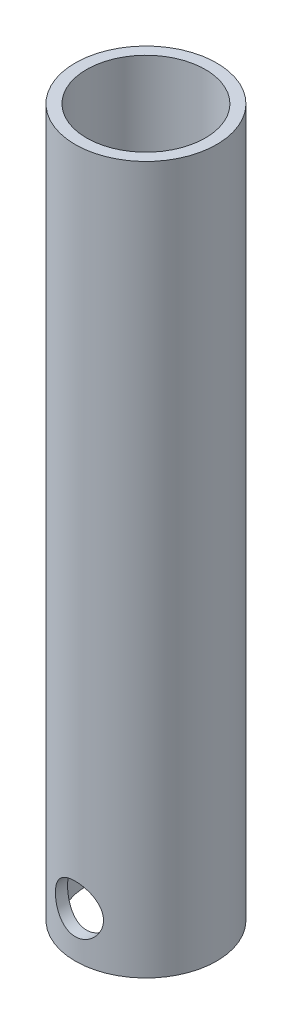
from build123d import *

# Parameters (mm, degrees)
SKETCH_1_R               = 12.5
SKETCH_1_R_2             = 10.5
EXTRUDE_1_DEPTH          = 125
CUT_EXTRUDE_1_DEPTH      = 127.24381173
CUT_EXTRUDE_1_DEPTH_BACK = 127.24381173
SKETCH_2_R               = 4.25
SKETCH_4_R               = 0.5
CUT_EXTRUDE_3_DEPTH      = 25


with BuildPart() as part:
    # Эскиз1 → Бобышка-Вытянуть1 (new body)
    with BuildSketch(Plane(origin=(0, 0, 0), x_dir=(1, 0, 0), z_dir=(0, 1, 0))):
        with Locations(Location((0, 0, 0), (0, 0, 270))):
            Circle(SKETCH_1_R)
        with Locations(Location((0, 0, 0), (0, 0, 270))):
            Circle(SKETCH_1_R_2, mode=Mode.SUBTRACT)
    extrude(amount=EXTRUDE_1_DEPTH)

    # Эскиз2 → Вырез-Вытянуть1 (cut, two sides: drawn at the far end of the back side and taken through both)
    with BuildSketch(Plane.XY.offset(-CUT_EXTRUDE_1_DEPTH_BACK)):
        with Locations((0, 8)):
            Circle(SKETCH_2_R)
    extrude(amount=CUT_EXTRUDE_1_DEPTH + CUT_EXTRUDE_1_DEPTH_BACK, mode=Mode.SUBTRACT)

    # Эскиз4 → Вырез-Вытянуть3 (cut)
    with BuildSketch(Plane(origin=(0, 0, 0), x_dir=(0, 0, -1), z_dir=(1, 0, 0))):
        with Locations((0, 56)):
            Circle(SKETCH_4_R)
    extrude(amount=-CUT_EXTRUDE_3_DEPTH, mode=Mode.SUBTRACT)


solid = part.part
